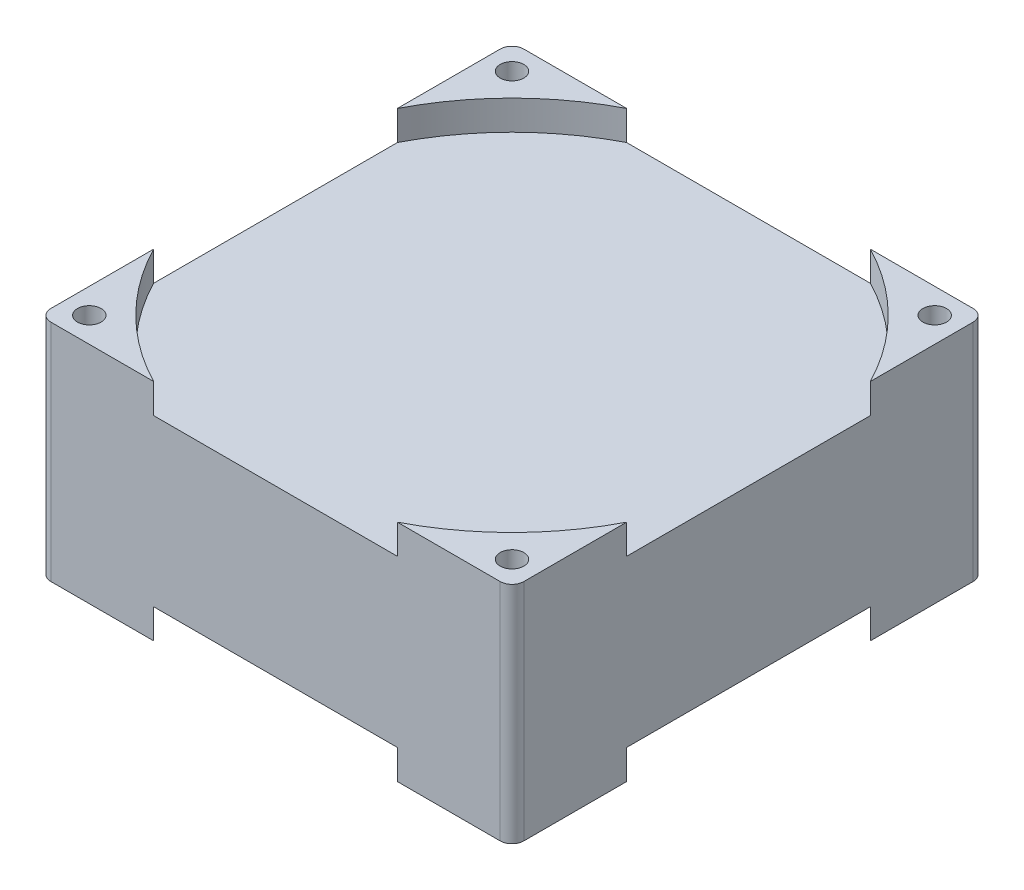
from build123d import *

# Parameters (mm, degrees)
SKETCH1_W          = 80
SKETCH1_H          = 80
BODY_DEPTH         = 38
SKETCH2_R          = 2
CUT_EXTRUDE1_DEPTH = 38
CUT_EXTRUDE2_DEPTH = 5
FILLET1_R          = 2
SKETCH4_W          = 1.709615385
SKETCH4_H          = 6.960576923
CUT_EXTRUDE3_DEPTH = 1


with BuildPart() as part:
    # Sketch1 → Body (new body)
    with BuildSketch(Plane(origin=(0, 0, 0), x_dir=(1, 0, 0), z_dir=(0, 1, 0))):
        Rectangle(SKETCH1_W, SKETCH1_H)
    extrude(amount=BODY_DEPTH)

    # Sketch2 → Cut-Extrude1 (cut)
    with BuildSketch(Plane(origin=(0, 38, 0), x_dir=(1, 0, 0), z_dir=(0, 1, 0))):
        with Locations(Location((-35.75, 35.75, 0), (0, 0, 270))):
            Circle(SKETCH2_R)
        with Locations(Location((35.75, 35.75, 0), (0, 0, 270))):
            Circle(SKETCH2_R)
        with Locations(Location((35.75, -35.75, 0), (0, 0, 270))):
            Circle(SKETCH2_R)
        with Locations(Location((-35.75, -35.75, 0), (0, 0, 270))):
            Circle(SKETCH2_R)
    extrude(amount=-CUT_EXTRUDE1_DEPTH, mode=Mode.SUBTRACT)

    # Sketch3 → Cut-Extrude2 (cut)
    with BuildSketch(Plane(origin=(0, 38, 0), x_dir=(1, 0, 0), z_dir=(0, 1, 0))):
        with BuildLine():
            Line((-40, 20.615528128), (-40, -20.615528128))
            ThreePointArc((-40, -20.615528128), (-31.819805153, -31.819805153), (-20.615528128, -40))
            Line((-20.615528128, -40), (20.615528128, -40))
            ThreePointArc((20.615528128, -40), (31.819805153, -31.819805153), (40, -20.615528128))
            Line((40, -20.615528128), (40, 20.615528128))
            ThreePointArc((40, 20.615528128), (31.819805153, 31.819805153), (20.615528128, 40))
            Line((20.615528128, 40), (-20.615528128, 40))
            ThreePointArc((-20.615528128, 40), (-31.819805153, 31.819805153), (-40, 20.615528128))
        make_face()
    cut_extrude2 = extrude(amount=-CUT_EXTRUDE2_DEPTH, mode=Mode.SUBTRACT)

    # Mirror1: Cut-Extrude2 across plane
    add(cut_extrude2.mirror(Plane.ZX.offset(19)), mode=Mode.SUBTRACT)

    # Fillet1
    fillet1_edges = [part.edges().sort_by_distance(p)[0] for p in [
        (40, 19, 40),
        (-40, 19, 40),
        (-40, 19, -40),
        (40, 19, -40),
    ]]
    fillet(fillet1_edges, radius=FILLET1_R)

    # Sketch4 → Cut-Extrude3 (cut)
    # profile 1 of 12: a face of its own
    with BuildSketch(Plane.ZY.offset(40)):
        Polygon((-34.596634615, 26.038548693), (-29.467788462, 26.038548693), (-29.467788462, 24.328933309), (-31.177403846, 24.328933309), (-31.177403846, 16.513548693), (-32.887019231, 16.513548693), (-32.887019231, 24.328933309), (-34.596634615, 24.328933309), align=None)
    # profile 2 of 12: a face of its own
    with BuildSketch(Plane.ZY.offset(40)):
        with BuildLine():
            Line((-28.36875, 26.282779462), (-26.659134615, 26.282779462))
            Line((-26.659134615, 26.282779462), (-26.659134615, 22.720444727))
            add(Edge.make_bspline(
                [(-26.659134615, 22.720444727), (-26.573017665, 22.790480118), (-26.405160806, 22.926991231), (-26.141787891, 23.104832819), (-25.878959731, 23.256592871), (-25.613887331, 23.379584016), (-25.347720672, 23.475964976), (-25.080000128, 23.544316743), (-24.810467967, 23.589161535), (-24.629777635, 23.593878662), (-24.539287861, 23.596241001)],
                knots=[0, 0, 0, 0, 1.13710654, 2.216417683, 3.252896077, 4.244436563, 5.207303112, 6.149540546, 7.073289332, 8, 8, 8, 8], degree=3))
            add(Edge.make_bspline(
                [(-24.539287861, 23.596241001), (-24.45269522, 23.593943337), (-24.282706595, 23.589432829), (-24.033322976, 23.55685279), (-23.794463271, 23.500790943), (-23.565539061, 23.423724215), (-23.3481253, 23.320080819), (-23.139394764, 23.198675667), (-22.941828495, 23.053220939), (-22.821620674, 22.94109734), (-22.760982572, 22.884537275)],
                knots=[0, 0, 0, 0, 1.056403236, 2.073808271, 3.062028718, 4.046096703, 5.014652014, 5.995532726, 6.988858718, 8, 8, 8, 8], degree=3))
            add(Edge.make_bspline(
                [(-22.760982572, 22.884537275), (-22.711182683, 22.831687074), (-22.610860359, 22.725219869), (-22.485911582, 22.541672866), (-22.37801956, 22.341744633), (-22.290102944, 22.12355646), (-22.224718005, 21.887006782), (-22.174096804, 21.63404433), (-22.146102203, 21.361907041), (-22.142647282, 21.174346641), (-22.140865385, 21.077611193)],
                knots=[0, 0, 0, 0, 0.887296576, 1.787466942, 2.706642908, 3.663267187, 4.658426068, 5.705361056, 6.816525637, 8, 8, 8, 8], degree=3))
            Line((-22.140865385, 21.077611193), (-22.140865385, 16.513548693))
            Line((-22.140865385, 16.513548693), (-23.850480769, 16.513548693))
            Line((-23.850480769, 16.513548693), (-23.850480769, 19.539720568))
            add(Edge.make_bspline(
                [(-23.850480769, 19.539720568), (-23.850812951, 19.635762128), (-23.851448782, 19.819595581), (-23.857158552, 20.083585245), (-23.866482786, 20.323409763), (-23.879234101, 20.53914161), (-23.897037724, 20.729879207), (-23.914548838, 20.896989689), (-23.939121034, 21.039672033), (-23.975914783, 21.194709961), (-24.035793355, 21.360535536), (-24.122806668, 21.537298471), (-24.239032545, 21.683182222), (-24.373535256, 21.803499741), (-24.529051829, 21.895330623), (-24.700014923, 21.963155319), (-24.889347248, 22.00129825), (-25.020583896, 22.006195284), (-25.088807091, 22.008741001)],
                knots=[0, 0, 0, 0, 1.461461505, 2.797388094, 4.017818807, 5.113567707, 6.085313608, 6.932873269, 7.669572396, 8.286941306, 9.355291607, 10.346554054, 11.270113241, 12.175128673, 13.078071705, 14.003657132, 14.962203834, 16, 16, 16, 16], degree=3))
            add(Edge.make_bspline(
                [(-25.088807091, 22.008741001), (-25.177681703, 22.0052666), (-25.351752649, 21.998461593), (-25.601378087, 21.928412188), (-25.831624713, 21.817690212), (-26.039805335, 21.664234535), (-26.221212655, 21.472025189), (-26.373203994, 21.246736639), (-26.497524587, 20.990622261), (-26.551258186, 20.803859227), (-26.578996394, 20.707448934)],
                knots=[0, 0, 0, 0, 0.993549393, 1.945978497, 2.879753144, 3.843180486, 4.826017097, 5.826060929, 6.877775219, 8, 8, 8, 8], degree=3))
            add(Edge.make_bspline(
                [(-26.578996394, 20.707448934), (-26.585903267, 20.677649914), (-26.601653198, 20.6096984), (-26.613714793, 20.493761444), (-26.631614009, 20.353613531), (-26.63782296, 20.188414819), (-26.649453796, 19.998420111), (-26.653636702, 19.783322006), (-26.657847826, 19.542918283), (-26.658691897, 19.37435929), (-26.659134615, 19.285949535)],
                knots=[0, 0, 0, 0, 0.514379255, 1.17295301, 1.959069106, 2.891908278, 3.953016936, 5.163065833, 6.51201855, 8, 8, 8, 8], degree=3))
            Line((-26.659134615, 19.285949535), (-26.659134615, 16.513548693))
            Line((-26.659134615, 16.513548693), (-28.36875, 16.513548693))
            Line((-28.36875, 16.513548693), (-28.36875, 26.282779462))
        make_face()
    # profile 3 of 12: a face of its own
    with BuildSketch(Plane.ZY.offset(40)):
        with BuildLine():
            add(Edge.make_bspline(
                [(-19.702373798, 26.404894847), (-19.628689387, 26.401279611), (-19.484002947, 26.394180747), (-19.276719932, 26.32498261), (-19.086476134, 26.216378203), (-18.91829534, 26.067370368), (-18.778418282, 25.889427759), (-18.671547015, 25.690209177), (-18.612013484, 25.469481405), (-18.603745158, 25.317004968), (-18.599519231, 25.239074535)],
                knots=[0, 0, 0, 0, 0.989868614, 1.943702388, 2.910836514, 3.924849579, 4.949916355, 5.946401046, 6.950409252, 8, 8, 8, 8], degree=3))
            add(Edge.make_bspline(
                [(-18.599519231, 25.239074535), (-18.603593961, 25.161718405), (-18.611533768, 25.010986304), (-18.672917216, 24.793255014), (-18.775499042, 24.594133193), (-18.916509016, 24.418833361), (-19.082866511, 24.272225385), (-19.268953336, 24.161649331), (-19.474249978, 24.096300671), (-19.616691322, 24.088608381), (-19.689017428, 24.084702539)],
                knots=[0, 0, 0, 0, 1.05296456, 2.051751585, 3.055639087, 4.085634717, 5.099016424, 6.062201612, 7.016062274, 8, 8, 8, 8], degree=3))
            add(Edge.make_bspline(
                [(-19.689017428, 24.084702539), (-19.763345043, 24.088304852), (-19.909290249, 24.095378134), (-20.118273411, 24.164738178), (-20.311054576, 24.272487255), (-20.478505802, 24.424539551), (-20.619984765, 24.603746577), (-20.722187853, 24.80760314), (-20.786118412, 25.029840244), (-20.793706914, 25.18457496), (-20.797596154, 25.263879222)],
                knots=[0, 0, 0, 0, 0.989065327, 1.942068821, 2.907541208, 3.917690034, 4.939857478, 5.938239964, 6.943311734, 8, 8, 8, 8], degree=3))
            add(Edge.make_bspline(
                [(-20.797596154, 25.263879222), (-20.793363597, 25.339921798), (-20.785049351, 25.489296461), (-20.725159207, 25.705116808), (-20.620738495, 25.900986214), (-20.481868985, 26.075671417), (-20.315165385, 26.221899696), (-20.125035793, 26.327205716), (-19.9191478, 26.393545772), (-19.775377897, 26.401072761), (-19.702373798, 26.404894847)],
                knots=[0, 0, 0, 0, 1.038616768, 2.040212704, 3.031499824, 4.052181184, 5.074969369, 6.039807101, 7.004644834, 8, 8, 8, 8], degree=3))
        make_face()
    # profile 4 of 12: a face of its own
    with BuildSketch(Plane.ZY.offset(40)):
        with Locations((-19.698557693, 19.993837154)):
            Rectangle(SKETCH4_W, SKETCH4_H)
    # profile 5 of 12: a face of its own
    with BuildSketch(Plane.ZY.offset(40)):
        with BuildLine():
            Line((-12.982211538, 22.399891842), (-14.027824519, 21.276048693))
            add(Edge.make_bspline(
                [(-14.027824519, 21.276048693), (-14.080036985, 21.333824617), (-14.179899652, 21.444328073), (-14.332779745, 21.594968981), (-14.483383155, 21.720408358), (-14.6289034, 21.825782662), (-14.772312521, 21.906592157), (-14.912418468, 21.964732779), (-15.049288463, 22.00164131), (-15.140011682, 22.00641898), (-15.184104567, 22.008741001)],
                knots=[0, 0, 0, 0, 1.327646587, 2.539285, 3.655602211, 4.666613517, 5.598770349, 6.454635452, 7.248928967, 8, 8, 8, 8], degree=3))
            add(Edge.make_bspline(
                [(-15.184104567, 22.008741001), (-15.228722138, 22.00738121), (-15.314150907, 22.004777634), (-15.434710042, 21.98244548), (-15.540629308, 21.943784406), (-15.630255766, 21.891085759), (-15.702263249, 21.826166438), (-15.752679046, 21.751900267), (-15.786533717, 21.670597097), (-15.789397603, 21.612844315), (-15.790865385, 21.583245208)],
                knots=[0, 0, 0, 0, 1.295068245, 2.479652818, 3.543291146, 4.55379989, 5.481948265, 6.332409746, 7.145336708, 8, 8, 8, 8], degree=3))
            add(Edge.make_bspline(
                [(-15.790865385, 21.583245208), (-15.785892406, 21.538389767), (-15.775574053, 21.445319938), (-15.70470128, 21.337372822), (-15.610931483, 21.257742445), (-15.50284202, 21.183641806), (-15.356460905, 21.100789358), (-15.245412476, 21.044057866), (-15.184104567, 21.012737395)],
                knots=[0, 0, 0, 0, 0.916701701, 1.902049539, 2.5493345, 3.440293453, 4.586830489, 6, 6, 6, 6], degree=3))
            Line((-15.184104567, 21.012737395), (-14.565895433, 20.699816722))
            add(Edge.make_bspline(
                [(-14.565895433, 20.699816722), (-14.48724741, 20.659881811), (-14.334655474, 20.582400582), (-14.120125505, 20.457374215), (-13.921982206, 20.336189681), (-13.744200274, 20.211991903), (-13.585691567, 20.086938611), (-13.447581967, 19.959793192), (-13.326521619, 19.834586398), (-13.191522337, 19.666718317), (-13.056482539, 19.443131691), (-12.943901288, 19.152367704), (-12.872109593, 18.841023405), (-12.864166669, 18.625530143), (-12.860096154, 18.515096169)],
                knots=[0, 0, 0, 0, 1.076693506, 2.088987655, 3.030641824, 3.911722491, 4.735175175, 5.493635918, 6.202154166, 6.859459289, 8.120623445, 9.372284821, 10.653373066, 12, 12, 12, 12], degree=3))
            add(Edge.make_bspline(
                [(-12.860096154, 18.515096169), (-12.862548666, 18.440592714), (-12.867348882, 18.294769682), (-12.897694836, 18.08013208), (-12.952204029, 17.8760435), (-13.023938045, 17.679322607), (-13.120561614, 17.493526717), (-13.237867362, 17.317755153), (-13.374002986, 17.149700133), (-13.532567428, 16.995110488), (-13.706272123, 16.85103463), (-13.899374205, 16.729856488), (-14.10333554, 16.62331305), (-14.323544463, 16.540112111), (-14.55691117, 16.472658255), (-14.805436094, 16.425914423), (-15.06827594, 16.396497332), (-15.248260724, 16.393149979), (-15.340564904, 16.391433309)],
                knots=[0, 0, 0, 0, 0.976600749, 1.911466839, 2.833459288, 3.740827163, 4.650527853, 5.570709661, 6.506801416, 7.479409329, 8.468875524, 9.458587492, 10.461481786, 11.480119772, 12.538142914, 13.641687514, 14.790552763, 16, 16, 16, 16], degree=3))
            add(Edge.make_bspline(
                [(-15.340564904, 16.391433309), (-15.462860015, 16.395327728), (-15.70291455, 16.402972132), (-16.053496819, 16.456221952), (-16.384539554, 16.548398289), (-16.696315112, 16.677525546), (-16.990733073, 16.84206907), (-17.26358882, 17.046231563), (-17.519612555, 17.284693733), (-17.668569824, 17.467583111), (-17.744711538, 17.561069727)],
                knots=[0, 0, 0, 0, 1.056901255, 2.07460411, 3.05625841, 4.019970729, 4.984811261, 5.963335951, 6.958928997, 8, 8, 8, 8], degree=3))
            Line((-17.744711538, 17.561069727), (-16.708638822, 18.711625616))
            add(Edge.make_bspline(
                [(-16.708638822, 18.711625616), (-16.658157861, 18.658381183), (-16.557936642, 18.55267357), (-16.389004167, 18.413283791), (-16.210261643, 18.286240261), (-16.019719241, 18.179565148), (-15.829138336, 18.093429795), (-15.646291683, 18.02881623), (-15.474625228, 17.988210967), (-15.363012124, 17.981919495), (-15.310036058, 17.978933309)],
                knots=[0, 0, 0, 0, 1.087861918, 2.159761696, 3.243809206, 4.338405912, 5.394481878, 6.343674753, 7.213841449, 8, 8, 8, 8], degree=3))
            add(Edge.make_bspline(
                [(-15.310036058, 17.978933309), (-15.257088667, 17.980466701), (-15.155309169, 17.983414303), (-15.010654147, 18.014075153), (-14.882439736, 18.065620571), (-14.773709142, 18.137089602), (-14.683269943, 18.219125134), (-14.619545652, 18.312358998), (-14.577407776, 18.41122238), (-14.572286411, 18.480343893), (-14.569711538, 18.515096169)],
                knots=[0, 0, 0, 0, 1.255011871, 2.412479185, 3.488767498, 4.514443302, 5.48617286, 6.365347346, 7.178144445, 8, 8, 8, 8], degree=3))
            add(Edge.make_bspline(
                [(-14.569711538, 18.515096169), (-14.572009089, 18.547822753), (-14.576726402, 18.615016739), (-14.614073521, 18.71419987), (-14.672709234, 18.812407083), (-14.754033768, 18.909915271), (-14.85912925, 19.005933269), (-14.98761957, 19.099692005), (-15.136540452, 19.196193623), (-15.246541892, 19.253792166), (-15.304311899, 19.284041482)],
                knots=[0, 0, 0, 0, 0.704666567, 1.446816302, 2.258757648, 3.165368109, 4.175243826, 5.322435858, 6.59381024, 8, 8, 8, 8], degree=3))
            Line((-15.304311899, 19.284041482), (-15.871003606, 19.570249414))
            add(Edge.make_bspline(
                [(-15.871003606, 19.570249414), (-15.999551907, 19.639182156), (-16.246316448, 19.771507175), (-16.579849862, 19.998416461), (-16.862137747, 20.239965913), (-17.093410143, 20.494857842), (-17.277688446, 20.762376963), (-17.406234926, 21.045929315), (-17.487102403, 21.34282676), (-17.49599912, 21.545848454), (-17.500480769, 21.648119006)],
                knots=[0, 0, 0, 0, 1.255999728, 2.41104856, 3.467751088, 4.449286722, 5.368722015, 6.253902015, 7.120417131, 8, 8, 8, 8], degree=3))
            add(Edge.make_bspline(
                [(-17.500480769, 21.648119006), (-17.49892657, 21.714401165), (-17.495875426, 21.844523812), (-17.463394158, 22.035617938), (-17.414321932, 22.219307972), (-17.345075736, 22.395885631), (-17.256372567, 22.565526127), (-17.147695796, 22.727476609), (-17.017719576, 22.88144265), (-16.870604994, 23.026928291), (-16.707376748, 23.159428329), (-16.532698518, 23.276854346), (-16.347086969, 23.376879477), (-16.149018813, 23.456626627), (-15.941011603, 23.520100395), (-15.721692269, 23.563245335), (-15.491996529, 23.590685667), (-15.334921276, 23.594362985), (-15.254702524, 23.596241001)],
                knots=[0, 0, 0, 0, 0.959035663, 1.882742823, 2.798841253, 3.708806893, 4.623422363, 5.566085165, 6.527241613, 7.536786942, 8.55815439, 9.567237405, 10.580975912, 11.605536372, 12.654523293, 13.725718749, 14.838518481, 16, 16, 16, 16], degree=3))
            add(Edge.make_bspline(
                [(-15.254702524, 23.596241001), (-15.143799581, 23.592589619), (-14.923676802, 23.585342269), (-14.599038996, 23.52669667), (-14.285472549, 23.428126954), (-13.983856535, 23.292314369), (-13.698070677, 23.121636548), (-13.434399544, 22.914376029), (-13.191058702, 22.675636505), (-13.052518558, 22.492719464), (-12.982211538, 22.399891842)],
                knots=[0, 0, 0, 0, 0.996590028, 1.978055413, 2.954661574, 3.945146934, 4.945404762, 5.939399542, 6.954276554, 8, 8, 8, 8], degree=3))
        make_face()
    # profile 6 of 12: a face of its own
    with BuildSketch(Plane.ZY.offset(40)):
        with BuildLine():
            add(Edge.make_bspline(
                [(-7.002373798, 26.404894847), (-6.928689387, 26.401279611), (-6.784002947, 26.394180747), (-6.576719932, 26.32498261), (-6.386476134, 26.216378203), (-6.21829534, 26.067370368), (-6.078418282, 25.889427759), (-5.971547015, 25.690209177), (-5.912013484, 25.469481405), (-5.903745158, 25.317004968), (-5.899519231, 25.239074535)],
                knots=[0, 0, 0, 0, 0.989868614, 1.943702388, 2.910836514, 3.924849579, 4.949916355, 5.946401046, 6.950409252, 8, 8, 8, 8], degree=3))
            add(Edge.make_bspline(
                [(-5.899519231, 25.239074535), (-5.903593961, 25.161718405), (-5.911533768, 25.010986304), (-5.972917216, 24.793255014), (-6.075499042, 24.594133193), (-6.216509016, 24.418833361), (-6.382866511, 24.272225385), (-6.568953336, 24.161649331), (-6.774249978, 24.096300671), (-6.916691322, 24.088608381), (-6.989017428, 24.084702539)],
                knots=[0, 0, 0, 0, 1.05296456, 2.051751585, 3.055639087, 4.085634717, 5.099016424, 6.062201612, 7.016062274, 8, 8, 8, 8], degree=3))
            add(Edge.make_bspline(
                [(-6.989017428, 24.084702539), (-7.063345043, 24.088304852), (-7.209290249, 24.095378134), (-7.418273411, 24.164738178), (-7.611054576, 24.272487255), (-7.778505802, 24.424539551), (-7.919984765, 24.603746577), (-8.022187853, 24.80760314), (-8.086118412, 25.029840244), (-8.093706914, 25.18457496), (-8.097596154, 25.263879222)],
                knots=[0, 0, 0, 0, 0.989065327, 1.942068821, 2.907541208, 3.917690034, 4.939857478, 5.938239964, 6.943311734, 8, 8, 8, 8], degree=3))
            add(Edge.make_bspline(
                [(-8.097596154, 25.263879222), (-8.093363597, 25.339921798), (-8.085049351, 25.489296461), (-8.025159207, 25.705116808), (-7.920738495, 25.900986214), (-7.781868985, 26.075671417), (-7.615165385, 26.221899696), (-7.425035793, 26.327205716), (-7.2191478, 26.393545772), (-7.075377897, 26.401072761), (-7.002373798, 26.404894847)],
                knots=[0, 0, 0, 0, 1.038616768, 2.040212704, 3.031499824, 4.052181184, 5.074969369, 6.039807101, 7.004644834, 8, 8, 8, 8], degree=3))
        make_face()
    # profile 7 of 12: a face of its own
    with BuildSketch(Plane.ZY.offset(40)):
        with Locations((-6.998557693, 19.993837154)):
            Rectangle(SKETCH4_W, SKETCH4_H)
    # profile 8 of 12: a face of its own
    with BuildSketch(Plane.ZY.offset(40)):
        with BuildLine():
            Line((-0.282211538, 22.399891842), (-1.327824519, 21.276048693))
            add(Edge.make_bspline(
                [(-1.327824519, 21.276048693), (-1.380036985, 21.333824617), (-1.479899652, 21.444328073), (-1.632779745, 21.594968981), (-1.783383155, 21.720408358), (-1.9289034, 21.825782662), (-2.072312521, 21.906592157), (-2.212418468, 21.964732779), (-2.349288463, 22.00164131), (-2.440011682, 22.00641898), (-2.484104567, 22.008741001)],
                knots=[0, 0, 0, 0, 1.327646587, 2.539285, 3.655602211, 4.666613517, 5.598770349, 6.454635452, 7.248928967, 8, 8, 8, 8], degree=3))
            add(Edge.make_bspline(
                [(-2.484104567, 22.008741001), (-2.528722138, 22.00738121), (-2.614150907, 22.004777634), (-2.734710042, 21.98244548), (-2.840629308, 21.943784406), (-2.930255766, 21.891085759), (-3.002263249, 21.826166438), (-3.052679046, 21.751900267), (-3.086533717, 21.670597097), (-3.089397603, 21.612844315), (-3.090865385, 21.583245208)],
                knots=[0, 0, 0, 0, 1.295068245, 2.479652818, 3.543291146, 4.55379989, 5.481948265, 6.332409746, 7.145336708, 8, 8, 8, 8], degree=3))
            add(Edge.make_bspline(
                [(-3.090865385, 21.583245208), (-3.085892406, 21.538389767), (-3.075574053, 21.445319938), (-3.00470128, 21.337372822), (-2.910931483, 21.257742445), (-2.80284202, 21.183641806), (-2.656460905, 21.100789358), (-2.545412476, 21.044057866), (-2.484104567, 21.012737395)],
                knots=[0, 0, 0, 0, 0.916701701, 1.902049539, 2.5493345, 3.440293453, 4.586830489, 6, 6, 6, 6], degree=3))
            Line((-2.484104567, 21.012737395), (-1.865895433, 20.699816722))
            add(Edge.make_bspline(
                [(-1.865895433, 20.699816722), (-1.78724741, 20.659881811), (-1.634655474, 20.582400582), (-1.420125505, 20.457374215), (-1.221982206, 20.336189681), (-1.044200274, 20.211991903), (-0.885691567, 20.086938611), (-0.747581967, 19.959793192), (-0.626521619, 19.834586398), (-0.491522337, 19.666718317), (-0.356482539, 19.443131691), (-0.243901288, 19.152367704), (-0.172109593, 18.841023405), (-0.164166669, 18.625530143), (-0.160096154, 18.515096169)],
                knots=[0, 0, 0, 0, 1.076693506, 2.088987655, 3.030641824, 3.911722491, 4.735175175, 5.493635918, 6.202154166, 6.859459289, 8.120623445, 9.372284821, 10.653373066, 12, 12, 12, 12], degree=3))
            add(Edge.make_bspline(
                [(-0.160096154, 18.515096169), (-0.162548666, 18.440592714), (-0.167348882, 18.294769682), (-0.197694836, 18.08013208), (-0.252204029, 17.8760435), (-0.323938045, 17.679322607), (-0.420561614, 17.493526717), (-0.537867362, 17.317755153), (-0.674002986, 17.149700133), (-0.832567428, 16.995110488), (-1.006272123, 16.85103463), (-1.199374205, 16.729856488), (-1.40333554, 16.62331305), (-1.623544463, 16.540112111), (-1.85691117, 16.472658255), (-2.105436094, 16.425914423), (-2.36827594, 16.396497332), (-2.548260724, 16.393149979), (-2.640564904, 16.391433309)],
                knots=[0, 0, 0, 0, 0.976600749, 1.911466839, 2.833459288, 3.740827163, 4.650527853, 5.570709661, 6.506801416, 7.479409329, 8.468875524, 9.458587492, 10.461481786, 11.480119772, 12.538142914, 13.641687514, 14.790552763, 16, 16, 16, 16], degree=3))
            add(Edge.make_bspline(
                [(-2.640564904, 16.391433309), (-2.762860015, 16.395327728), (-3.00291455, 16.402972132), (-3.353496819, 16.456221952), (-3.684539554, 16.548398289), (-3.996315112, 16.677525546), (-4.290733073, 16.84206907), (-4.56358882, 17.046231563), (-4.819612555, 17.284693733), (-4.968569824, 17.467583111), (-5.044711538, 17.561069727)],
                knots=[0, 0, 0, 0, 1.056901255, 2.07460411, 3.05625841, 4.019970729, 4.984811261, 5.963335951, 6.958928997, 8, 8, 8, 8], degree=3))
            Line((-5.044711538, 17.561069727), (-4.008638822, 18.711625616))
            add(Edge.make_bspline(
                [(-4.008638822, 18.711625616), (-3.958157861, 18.658381183), (-3.857936642, 18.55267357), (-3.689004167, 18.413283791), (-3.510261643, 18.286240261), (-3.319719241, 18.179565148), (-3.129138336, 18.093429795), (-2.946291683, 18.02881623), (-2.774625228, 17.988210967), (-2.663012124, 17.981919495), (-2.610036058, 17.978933309)],
                knots=[0, 0, 0, 0, 1.087861918, 2.159761696, 3.243809206, 4.338405912, 5.394481878, 6.343674753, 7.213841449, 8, 8, 8, 8], degree=3))
            add(Edge.make_bspline(
                [(-2.610036058, 17.978933309), (-2.557088667, 17.980466701), (-2.455309169, 17.983414303), (-2.310654147, 18.014075153), (-2.182439736, 18.065620571), (-2.073709142, 18.137089602), (-1.983269943, 18.219125134), (-1.919545652, 18.312358998), (-1.877407776, 18.41122238), (-1.872286411, 18.480343893), (-1.869711538, 18.515096169)],
                knots=[0, 0, 0, 0, 1.255011871, 2.412479185, 3.488767498, 4.514443302, 5.48617286, 6.365347346, 7.178144445, 8, 8, 8, 8], degree=3))
            add(Edge.make_bspline(
                [(-1.869711538, 18.515096169), (-1.872009089, 18.547822753), (-1.876726402, 18.615016739), (-1.914073521, 18.71419987), (-1.972709234, 18.812407083), (-2.054033768, 18.909915271), (-2.15912925, 19.005933269), (-2.28761957, 19.099692005), (-2.436540452, 19.196193623), (-2.546541892, 19.253792166), (-2.604311899, 19.284041482)],
                knots=[0, 0, 0, 0, 0.704666567, 1.446816302, 2.258757648, 3.165368109, 4.175243826, 5.322435858, 6.59381024, 8, 8, 8, 8], degree=3))
            Line((-2.604311899, 19.284041482), (-3.171003606, 19.570249414))
            add(Edge.make_bspline(
                [(-3.171003606, 19.570249414), (-3.299551907, 19.639182156), (-3.546316448, 19.771507175), (-3.879849862, 19.998416461), (-4.162137747, 20.239965913), (-4.393410143, 20.494857842), (-4.577688446, 20.762376963), (-4.706234926, 21.045929315), (-4.787102403, 21.34282676), (-4.79599912, 21.545848454), (-4.800480769, 21.648119006)],
                knots=[0, 0, 0, 0, 1.255999728, 2.41104856, 3.467751088, 4.449286722, 5.368722015, 6.253902015, 7.120417131, 8, 8, 8, 8], degree=3))
            add(Edge.make_bspline(
                [(-4.800480769, 21.648119006), (-4.79892657, 21.714401165), (-4.795875426, 21.844523812), (-4.763394158, 22.035617938), (-4.714321932, 22.219307972), (-4.645075736, 22.395885631), (-4.556372567, 22.565526127), (-4.447695796, 22.727476609), (-4.317719576, 22.88144265), (-4.170604994, 23.026928291), (-4.007376748, 23.159428329), (-3.832698518, 23.276854346), (-3.647086969, 23.376879477), (-3.449018813, 23.456626627), (-3.241011603, 23.520100395), (-3.021692269, 23.563245335), (-2.791996529, 23.590685667), (-2.634921276, 23.594362985), (-2.554702524, 23.596241001)],
                knots=[0, 0, 0, 0, 0.959035663, 1.882742823, 2.798841253, 3.708806893, 4.623422363, 5.566085165, 6.527241613, 7.536786942, 8.55815439, 9.567237405, 10.580975912, 11.605536372, 12.654523293, 13.725718749, 14.838518481, 16, 16, 16, 16], degree=3))
            add(Edge.make_bspline(
                [(-2.554702524, 23.596241001), (-2.443799581, 23.592589619), (-2.223676802, 23.585342269), (-1.899038996, 23.52669667), (-1.585472549, 23.428126954), (-1.283856535, 23.292314369), (-0.998070677, 23.121636548), (-0.734399544, 22.914376029), (-0.491058702, 22.675636505), (-0.352518558, 22.492719464), (-0.282211538, 22.399891842)],
                knots=[0, 0, 0, 0, 0.996590028, 1.978055413, 2.954661574, 3.945146934, 4.945404762, 5.939399542, 6.954276554, 8, 8, 8, 8], degree=3))
        make_face()
    # profile 9 of 12: a face of its own
    with BuildSketch(Plane.ZY.offset(40)):
        with BuildLine():
            Line((10.219711538, 23.474125616), (11.929326923, 23.474125616))
            Line((11.929326923, 23.474125616), (11.929326923, 16.513548693))
            Line((11.929326923, 16.513548693), (10.219711538, 16.513548693))
            Line((10.219711538, 16.513548693), (10.219711538, 17.272953741))
            add(Edge.make_bspline(
                [(10.219711538, 17.272953741), (10.135000726, 17.199034065), (9.970593768, 17.05557057), (9.711541601, 16.869423038), (9.451732453, 16.715875382), (9.189917935, 16.593583048), (8.922074068, 16.503282747), (8.646272482, 16.437903219), (8.358541341, 16.399347312), (8.162945676, 16.394098788), (8.063611779, 16.391433309)],
                knots=[0, 0, 0, 0, 1.129196829, 2.191548051, 3.199897424, 4.157751732, 5.089409408, 6.034969131, 7.002052659, 8, 8, 8, 8], degree=3))
            add(Edge.make_bspline(
                [(8.063611779, 16.391433309), (7.952105064, 16.393941861), (7.731761475, 16.398898902), (7.40843172, 16.451079763), (7.096224698, 16.530954201), (6.795393833, 16.643986513), (6.50648646, 16.790454231), (6.227291561, 16.966535807), (5.962595387, 17.178412757), (5.710194434, 17.416917705), (5.479097636, 17.679274845), (5.277070633, 17.961842696), (5.106776884, 18.260613657), (4.967264328, 18.574597164), (4.857519687, 18.90356277), (4.779287461, 19.248553856), (4.733130358, 19.609693635), (4.727417409, 19.855687909), (4.724519231, 19.980480785)],
                knots=[0, 0, 0, 0, 0.980476535, 1.937477201, 2.874147792, 3.812856188, 4.758993464, 5.720109578, 6.712210464, 7.737600662, 8.772720504, 9.783789959, 10.789002326, 11.793715968, 12.802552247, 13.835794126, 14.902098527, 16, 16, 16, 16], degree=3))
            add(Edge.make_bspline(
                [(4.724519231, 19.980480785), (4.72756088, 20.109703972), (4.733527414, 20.363189652), (4.777172251, 20.735167836), (4.853960798, 21.088712947), (4.958667501, 21.424314697), (5.093354493, 21.742031066), (5.257394251, 22.042382574), (5.45301838, 22.324584151), (5.67844051, 22.583832526), (5.921841044, 22.821446185), (6.182236586, 23.028307718), (6.455555119, 23.204046216), (6.742087093, 23.347517028), (7.041791587, 23.458384012), (7.353485375, 23.539436829), (7.678552157, 23.588071367), (7.899990283, 23.593495174), (8.012094351, 23.596241001)],
                knots=[0, 0, 0, 0, 1.136281865, 2.228943489, 3.287578264, 4.313574083, 5.316051562, 6.317280042, 7.318008486, 8.329309503, 9.333984563, 10.305318864, 11.248632312, 12.186624717, 13.117503092, 14.05354244, 15.014596925, 16, 16, 16, 16], degree=3))
            add(Edge.make_bspline(
                [(8.012094351, 23.596241001), (8.115939042, 23.594083606), (8.321410254, 23.589814898), (8.623423331, 23.543464905), (8.916332457, 23.473363831), (9.198539798, 23.373482419), (9.472360111, 23.247361817), (9.733083515, 23.089323301), (9.986413569, 22.90600916), (10.140984734, 22.762836933), (10.219711538, 22.689915881)],
                knots=[0, 0, 0, 0, 1.017011718, 2.012299608, 2.98747302, 3.965332399, 4.941441765, 5.936729654, 6.94912688, 8, 8, 8, 8], degree=3))
            Line((10.219711538, 22.689915881), (10.219711538, 23.474125616))
        make_face()
        with BuildLine():
            add(Edge.make_bspline(
                [(8.370808293, 22.008741001), (8.30268516, 22.006650748), (8.169168266, 22.002553989), (7.972813403, 21.977911697), (7.785157057, 21.93449088), (7.607537579, 21.870345947), (7.437307787, 21.792208073), (7.277052647, 21.694341672), (7.125449524, 21.578665666), (6.983390012, 21.447980568), (6.853881836, 21.304333752), (6.74223823, 21.147583953), (6.647359201, 20.981954687), (6.567116202, 20.806947964), (6.50968042, 20.620492913), (6.464191304, 20.425016848), (6.440585398, 20.218922829), (6.436306391, 20.078476133), (6.434134615, 20.007193525)],
                knots=[0, 0, 0, 0, 1.04836806, 2.054732945, 3.03993516, 4.00574415, 4.955904794, 5.917688631, 6.888591924, 7.88601754, 8.884115178, 9.859153345, 10.841239365, 11.818093293, 12.814750328, 13.83810466, 14.90274714, 16, 16, 16, 16], degree=3))
            add(Edge.make_bspline(
                [(6.434134615, 20.007193525), (6.436273217, 19.935264342), (6.440487306, 19.793528722), (6.464572989, 19.585696226), (6.508425218, 19.387364715), (6.572403967, 19.200137563), (6.65053686, 19.021488458), (6.745642163, 18.852241882), (6.862462369, 18.695390326), (6.992084072, 18.547222156), (7.137057913, 18.41491373), (7.289518867, 18.297435995), (7.451549433, 18.19914245), (7.621391692, 18.119700985), (7.798473947, 18.054962868), (7.985016274, 18.012087762), (8.179191256, 17.984678518), (8.311565468, 17.980861603), (8.378440505, 17.978933309)],
                knots=[0, 0, 0, 0, 1.099136573, 2.165835871, 3.191374663, 4.196217796, 5.183857741, 6.167377911, 7.154730987, 8.166690795, 9.170734848, 10.148332609, 11.103258353, 12.059567475, 13.009337315, 13.978056681, 14.978520572, 16, 16, 16, 16], degree=3))
            add(Edge.make_bspline(
                [(8.378440505, 17.978933309), (8.447832511, 17.98103528), (8.583878567, 17.985156286), (8.783436861, 18.009573691), (8.973614104, 18.053153714), (9.153619058, 18.117665891), (9.326201126, 18.19524289), (9.489802911, 18.291196907), (9.642649086, 18.406607469), (9.785513747, 18.538473963), (9.916421669, 18.683293741), (10.029609218, 18.842099065), (10.128199714, 19.009810904), (10.205736603, 19.190394578), (10.267311767, 19.380690715), (10.311490526, 19.581880333), (10.33552121, 19.794180339), (10.339698443, 19.939083366), (10.341826923, 20.012917684)],
                knots=[0, 0, 0, 0, 1.050008698, 2.058587853, 3.036635738, 3.995319155, 4.947022481, 5.895997462, 6.858296291, 7.838991643, 8.833936038, 9.806048392, 10.784806122, 11.771666913, 12.772873988, 13.80724452, 14.882696879, 16, 16, 16, 16], degree=3))
            add(Edge.make_bspline(
                [(10.341826923, 20.012917684), (10.339724892, 20.085482086), (10.335619014, 20.227221443), (10.311386888, 20.435088725), (10.266894485, 20.632327898), (10.20658664, 20.819301512), (10.127670345, 20.995582055), (10.029005253, 21.159214996), (9.917059306, 21.315869602), (9.784702045, 21.456776997), (9.642611314, 21.587688676), (9.487517288, 21.699609138), (9.324306271, 21.796065299), (9.151975492, 21.875259526), (8.968929244, 21.933311897), (8.778427001, 21.978259724), (8.57749653, 22.002539199), (8.440828678, 22.006639998), (8.370808293, 22.008741001)],
                knots=[0, 0, 0, 0, 1.106611376, 2.161533483, 3.185006901, 4.184773755, 5.152708835, 6.122342771, 7.094156588, 8.082475533, 9.064254463, 10.03606828, 10.992420271, 11.951521816, 12.920622147, 13.915721683, 14.932141191, 16, 16, 16, 16], degree=3))
        make_face(mode=Mode.SUBTRACT)
    # profile 10 of 12: a face of its own
    with BuildSketch(Plane.ZY.offset(40)):
        with BuildLine():
            Line((16.447596154, 23.474125616), (17.058173077, 23.474125616))
            add(Edge.make_bspline(
                [(17.058173077, 23.474125616), (17.05858111, 23.584794882), (17.059352646, 23.794055416), (17.063909208, 24.090426547), (17.066981922, 24.351219368), (17.072470466, 24.576393765), (17.080195006, 24.765290164), (17.088113477, 24.917898239), (17.094044943, 25.035180857), (17.102407523, 25.101085406), (17.105874399, 25.128407467)],
                knots=[0, 0, 0, 0, 1.604323161, 3.033556972, 4.296844687, 5.385167547, 6.298701784, 7.037230881, 7.60086462, 8, 8, 8, 8], degree=3))
            add(Edge.make_bspline(
                [(17.105874399, 25.128407467), (17.122130999, 25.222146014), (17.153820613, 25.404874165), (17.258723468, 25.659560203), (17.411155772, 25.8814209), (17.572743374, 26.038021908), (17.722493655, 26.144929453), (17.848121696, 26.214754595), (17.9847193, 26.274616085), (18.132727808, 26.321554669), (18.290739563, 26.35989749), (18.460459786, 26.386551518), (18.640957332, 26.401240225), (18.765218305, 26.403657223), (18.828846154, 26.404894847)],
                knots=[0, 0, 0, 0, 1.43722947, 2.801646624, 4.13175475, 5.486897933, 6.18427957, 6.91287343, 7.658885333, 8.438447905, 9.260561323, 10.118602268, 11.036630026, 12, 12, 12, 12], degree=3))
            add(Edge.make_bspline(
                [(18.828846154, 26.404894847), (18.926334479, 26.401852577), (19.129383057, 26.39551614), (19.441350678, 26.344289944), (19.772326558, 26.265870932), (19.995153541, 26.192897354), (20.111057692, 26.154939919)],
                knots=[0, 0, 0, 0, 0.891275659, 1.856347963, 2.884972697, 4, 4, 4, 4], degree=3))
            Line((20.111057692, 26.154939919), (20.111057692, 24.825027059))
            add(Edge.make_bspline(
                [(20.111057692, 24.825027059), (20.048890782, 24.842215161), (19.930324589, 24.874996715), (19.759726623, 24.911387151), (19.60601268, 24.933858156), (19.509446115, 24.93770766), (19.464227764, 24.939510232)],
                knots=[0, 0, 0, 0, 1.174725213, 2.24046353, 3.176077791, 4, 4, 4, 4], degree=3))
            add(Edge.make_bspline(
                [(19.464227764, 24.939510232), (19.414461787, 24.938461507), (19.321208018, 24.936496357), (19.191944721, 24.911495821), (19.08126778, 24.872131366), (19.023861056, 24.827174308), (18.996754808, 24.80594653)],
                knots=[0, 0, 0, 0, 1.199997209, 2.248609783, 3.173030359, 4, 4, 4, 4], degree=3))
            add(Edge.make_bspline(
                [(18.996754808, 24.80594653), (18.980352148, 24.78499352), (18.944113314, 24.738701475), (18.911174539, 24.644239552), (18.894451889, 24.524848017), (18.891513664, 24.436492099), (18.889903846, 24.388082948)],
                knots=[0, 0, 0, 0, 0.721105823, 1.593158367, 2.681320256, 4, 4, 4, 4], degree=3))
            Line((18.889903846, 24.388082948), (18.884179687, 23.474125616))
            Line((18.884179687, 23.474125616), (19.988942308, 23.474125616))
            Line((19.988942308, 23.474125616), (19.988942308, 22.008741001))
            Line((19.988942308, 22.008741001), (18.767788462, 22.008741001))
            Line((18.767788462, 22.008741001), (18.767788462, 16.513548693))
            Line((18.767788462, 16.513548693), (17.058173077, 16.513548693))
            Line((17.058173077, 16.513548693), (17.058173077, 22.008741001))
            Line((17.058173077, 22.008741001), (16.447596154, 22.008741001))
            Line((16.447596154, 22.008741001), (16.447596154, 23.474125616))
        make_face()
    # profile 11 of 12: a face of its own
    with BuildSketch(Plane.ZY.offset(40)):
        with BuildLine():
            Line((26.216826923, 23.474125616), (27.926442308, 23.474125616))
            Line((27.926442308, 23.474125616), (27.926442308, 16.513548693))
            Line((27.926442308, 16.513548693), (26.216826923, 16.513548693))
            Line((26.216826923, 16.513548693), (26.216826923, 17.272953741))
            add(Edge.make_bspline(
                [(26.216826923, 17.272953741), (26.132116111, 17.199034065), (25.967709152, 17.05557057), (25.708656985, 16.869423038), (25.448847838, 16.715875382), (25.18703332, 16.593583048), (24.919189452, 16.503282747), (24.643387866, 16.437903219), (24.355656726, 16.399347312), (24.16006106, 16.394098788), (24.060727163, 16.391433309)],
                knots=[0, 0, 0, 0, 1.129196829, 2.191548051, 3.199897424, 4.157751732, 5.089409408, 6.034969131, 7.002052659, 8, 8, 8, 8], degree=3))
            add(Edge.make_bspline(
                [(24.060727163, 16.391433309), (23.949220448, 16.393941861), (23.728876859, 16.398898902), (23.405547105, 16.451079763), (23.093340082, 16.530954201), (22.792509218, 16.643986513), (22.503601844, 16.790454231), (22.224406945, 16.966535807), (21.959710772, 17.178412757), (21.707309819, 17.416917705), (21.476213021, 17.679274845), (21.274186018, 17.961842696), (21.103892269, 18.260613657), (20.964379713, 18.574597164), (20.854635071, 18.90356277), (20.776402846, 19.248553856), (20.730245743, 19.609693635), (20.724532794, 19.855687909), (20.721634615, 19.980480785)],
                knots=[0, 0, 0, 0, 0.980476535, 1.937477201, 2.874147792, 3.812856188, 4.758993464, 5.720109578, 6.712210464, 7.737600662, 8.772720504, 9.783789959, 10.789002326, 11.793715968, 12.802552247, 13.835794126, 14.902098527, 16, 16, 16, 16], degree=3))
            add(Edge.make_bspline(
                [(20.721634615, 19.980480785), (20.724676265, 20.109703972), (20.730642798, 20.363189652), (20.774287636, 20.735167836), (20.851076183, 21.088712947), (20.955782886, 21.424314697), (21.090469878, 21.742031066), (21.254509635, 22.042382574), (21.450133765, 22.324584151), (21.675555895, 22.583832526), (21.918956429, 22.821446185), (22.179351971, 23.028307718), (22.452670504, 23.204046216), (22.739202477, 23.347517028), (23.038906972, 23.458384012), (23.35060076, 23.539436829), (23.675667542, 23.588071367), (23.897105668, 23.593495174), (24.009209736, 23.596241001)],
                knots=[0, 0, 0, 0, 1.136281865, 2.228943489, 3.287578264, 4.313574083, 5.316051562, 6.317280042, 7.318008486, 8.329309503, 9.333984563, 10.305318864, 11.248632312, 12.186624717, 13.117503092, 14.05354244, 15.014596925, 16, 16, 16, 16], degree=3))
            add(Edge.make_bspline(
                [(24.009209736, 23.596241001), (24.113054426, 23.594083606), (24.318525639, 23.589814898), (24.620538716, 23.543464905), (24.913447842, 23.473363831), (25.195655182, 23.373482419), (25.469475496, 23.247361817), (25.7301989, 23.089323301), (25.983528954, 22.90600916), (26.138100118, 22.762836933), (26.216826923, 22.689915881)],
                knots=[0, 0, 0, 0, 1.017011718, 2.012299608, 2.98747302, 3.965332399, 4.941441765, 5.936729654, 6.94912688, 8, 8, 8, 8], degree=3))
            Line((26.216826923, 22.689915881), (26.216826923, 23.474125616))
        make_face()
        with BuildLine():
            add(Edge.make_bspline(
                [(24.367923678, 22.008741001), (24.299800544, 22.006650748), (24.166283651, 22.002553989), (23.969928787, 21.977911697), (23.782272441, 21.93449088), (23.604652964, 21.870345947), (23.434423172, 21.792208073), (23.274168031, 21.694341672), (23.122564908, 21.578665666), (22.980505397, 21.447980568), (22.850997221, 21.304333752), (22.739353614, 21.147583953), (22.644474586, 20.981954687), (22.564231586, 20.806947964), (22.506795804, 20.620492913), (22.461306689, 20.425016848), (22.437700782, 20.218922829), (22.433421776, 20.078476133), (22.43125, 20.007193525)],
                knots=[0, 0, 0, 0, 1.04836806, 2.054732945, 3.03993516, 4.00574415, 4.955904794, 5.917688631, 6.888591924, 7.88601754, 8.884115178, 9.859153345, 10.841239365, 11.818093293, 12.814750328, 13.83810466, 14.90274714, 16, 16, 16, 16], degree=3))
            add(Edge.make_bspline(
                [(22.43125, 20.007193525), (22.433388601, 19.935264342), (22.437602691, 19.793528722), (22.461688373, 19.585696226), (22.505540603, 19.387364715), (22.569519352, 19.200137563), (22.647652245, 19.021488458), (22.742757547, 18.852241882), (22.859577753, 18.695390326), (22.989199457, 18.547222156), (23.134173297, 18.41491373), (23.286634252, 18.297435995), (23.448664817, 18.19914245), (23.618507076, 18.119700985), (23.795589332, 18.054962868), (23.982131659, 18.012087762), (24.17630664, 17.984678518), (24.308680852, 17.980861603), (24.375555889, 17.978933309)],
                knots=[0, 0, 0, 0, 1.099136573, 2.165835871, 3.191374663, 4.196217796, 5.183857741, 6.167377911, 7.154730987, 8.166690795, 9.170734848, 10.148332609, 11.103258353, 12.059567475, 13.009337315, 13.978056681, 14.978520572, 16, 16, 16, 16], degree=3))
            add(Edge.make_bspline(
                [(24.375555889, 17.978933309), (24.444947896, 17.98103528), (24.580993951, 17.985156286), (24.780552245, 18.009573691), (24.970729489, 18.053153714), (25.150734443, 18.117665891), (25.323316511, 18.19524289), (25.486918295, 18.291196907), (25.639764471, 18.406607469), (25.782629132, 18.538473963), (25.913537053, 18.683293741), (26.026724602, 18.842099065), (26.125315099, 19.009810904), (26.202851988, 19.190394578), (26.264427151, 19.380690715), (26.308605911, 19.581880333), (26.332636595, 19.794180339), (26.336813828, 19.939083366), (26.338942308, 20.012917684)],
                knots=[0, 0, 0, 0, 1.050008698, 2.058587853, 3.036635738, 3.995319155, 4.947022481, 5.895997462, 6.858296291, 7.838991643, 8.833936038, 9.806048392, 10.784806122, 11.771666913, 12.772873988, 13.80724452, 14.882696879, 16, 16, 16, 16], degree=3))
            add(Edge.make_bspline(
                [(26.338942308, 20.012917684), (26.336840276, 20.085482086), (26.332734398, 20.227221443), (26.308502273, 20.435088725), (26.264009869, 20.632327898), (26.203702024, 20.819301512), (26.12478573, 20.995582055), (26.026120637, 21.159214996), (25.914174691, 21.315869602), (25.781817429, 21.456776997), (25.639726698, 21.587688676), (25.484632673, 21.699609138), (25.321421656, 21.796065299), (25.149090876, 21.875259526), (24.966044629, 21.933311897), (24.775542385, 21.978259724), (24.574611915, 22.002539199), (24.437944063, 22.006639998), (24.367923678, 22.008741001)],
                knots=[0, 0, 0, 0, 1.106611376, 2.161533483, 3.185006901, 4.184773755, 5.152708835, 6.122342771, 7.094156588, 8.082475533, 9.064254463, 10.03606828, 10.992420271, 11.951521816, 12.920622147, 13.915721683, 14.932141191, 16, 16, 16, 16], degree=3))
        make_face(mode=Mode.SUBTRACT)
    # profile 12 of 12: a face of its own
    with BuildSketch(Plane.ZY.offset(40)):
        with BuildLine():
            Line((29.636057692, 23.474125616), (31.345673077, 23.474125616))
            Line((31.345673077, 23.474125616), (31.345673077, 22.737617203))
            add(Edge.make_bspline(
                [(31.345673077, 22.737617203), (31.443205787, 22.813480154), (31.629609756, 22.958469), (31.912975973, 23.143330518), (32.180438599, 23.294632247), (32.437959661, 23.409720085), (32.690384425, 23.492520836), (32.941801092, 23.552008235), (33.195953765, 23.590099653), (33.366806053, 23.594194983), (33.452163462, 23.596241001)],
                knots=[0, 0, 0, 0, 1.276643801, 2.439914479, 3.493451431, 4.44993799, 5.350072675, 6.235028322, 7.118224225, 8, 8, 8, 8], degree=3))
            add(Edge.make_bspline(
                [(33.452163462, 23.596241001), (33.538747066, 23.593902826), (33.708717954, 23.589312793), (33.958990719, 23.557209228), (34.198102041, 23.498738467), (34.42874053, 23.42110511), (34.64855868, 23.318633532), (34.860249398, 23.196965159), (35.059265641, 23.048764848), (35.181828655, 22.935902607), (35.24382512, 22.878813116)],
                knots=[0, 0, 0, 0, 1.048836932, 2.058954983, 3.049370783, 4.026390553, 5.001981509, 5.982488534, 6.97947532, 8, 8, 8, 8], degree=3))
            add(Edge.make_bspline(
                [(35.24382512, 22.878813116), (35.293548568, 22.825907852), (35.393359379, 22.719710121), (35.518958745, 22.537978603), (35.626737128, 22.339857984), (35.715046537, 22.123062879), (35.780303633, 21.886402141), (35.830506807, 21.632734291), (35.858676684, 21.360638978), (35.862154388, 21.173712065), (35.863942308, 21.077611193)],
                knots=[0, 0, 0, 0, 0.889584746, 1.785680191, 2.700364693, 3.65222533, 4.649950538, 5.707241244, 6.821271309, 8, 8, 8, 8], degree=3))
            Line((35.863942308, 21.077611193), (35.863942308, 16.513548693))
            Line((35.863942308, 16.513548693), (34.154326923, 16.513548693))
            Line((34.154326923, 16.513548693), (34.154326923, 19.535904462))
            add(Edge.make_bspline(
                [(34.154326923, 19.535904462), (34.153965377, 19.634488443), (34.153272542, 19.823406342), (34.147953097, 20.093776248), (34.137566443, 20.337955385), (34.128099277, 20.556388331), (34.109511469, 20.748299503), (34.092748683, 20.914903846), (34.067027813, 21.054689912), (34.033560788, 21.2050508), (33.97511912, 21.366039626), (33.88439128, 21.535667952), (33.769290293, 21.679770996), (33.634517341, 21.799358993), (33.480221271, 21.893964067), (33.308266527, 21.960524629), (33.119574991, 22.002006806), (32.988096946, 22.006439157), (32.919816707, 22.008741001)],
                knots=[0, 0, 0, 0, 1.49886392, 2.872294502, 4.110984203, 5.214877267, 6.195405875, 7.042225351, 7.75923308, 8.355011229, 9.382752534, 10.352059385, 11.267231453, 12.171456522, 13.078624015, 14.003401117, 14.963110155, 16, 16, 16, 16], degree=3))
            add(Edge.make_bspline(
                [(32.919816707, 22.008741001), (32.831015383, 22.004237862), (32.657302732, 21.995428847), (32.406062133, 21.929000837), (32.175301829, 21.816026346), (31.966907321, 21.659692367), (31.782863394, 21.466678698), (31.631279932, 21.236487756), (31.506950353, 20.974675187), (31.453486786, 20.783509485), (31.425811298, 20.684552299)],
                knots=[0, 0, 0, 0, 0.984188326, 1.925263693, 2.85911992, 3.81709677, 4.80007086, 5.801799564, 6.862098548, 8, 8, 8, 8], degree=3))
            add(Edge.make_bspline(
                [(31.425811298, 20.684552299), (31.41893284, 20.653474132), (31.403592495, 20.58416357), (31.390977002, 20.467070952), (31.373427935, 20.328151898), (31.366852731, 20.164892363), (31.355419174, 19.978064988), (31.351190499, 19.767422603), (31.346954258, 19.533378244), (31.346114285, 19.369907152), (31.345673077, 19.284041482)],
                knots=[0, 0, 0, 0, 0.543362196, 1.211806945, 2.009705693, 2.934833164, 4.000995085, 5.207458376, 6.533175157, 8, 8, 8, 8], degree=3))
            Line((31.345673077, 19.284041482), (31.345673077, 16.513548693))
            Line((31.345673077, 16.513548693), (29.636057692, 16.513548693))
            Line((29.636057692, 16.513548693), (29.636057692, 23.474125616))
        make_face()
    extrude(amount=-CUT_EXTRUDE3_DEPTH, mode=Mode.SUBTRACT)


solid = part.part
